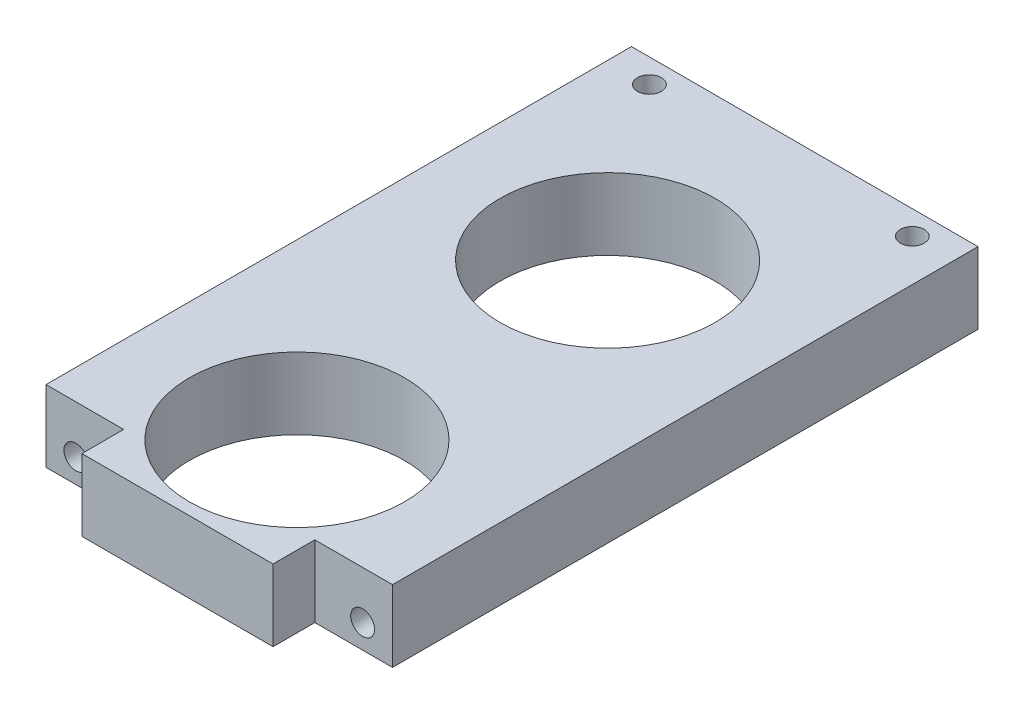
from build123d import *

# Parameters (mm, degrees)
SKETCH_1_W          = 29
SKETCH_1_H          = 52.5
SKETCH_1_R          = 9
EXTRUDE_1_DEPTH     = 6
SKETCH_2_W          = 6.5
SKETCH_2_H          = 3.5
CUT_EXTRUDE_1_DEPTH = 10
SKETCH_3_R          = 1
CUT_EXTRUDE_4_DEPTH = 8
SKETCH_4_R          = 1
CUT_EXTRUDE_5_DEPTH = 10


with BuildPart() as part:
    # 草图1 → 凸台-拉伸1 (new body)
    with BuildSketch(Plane(origin=(0, 0, 0), x_dir=(1, 0, 0), z_dir=(0, 1, 0))):
        Rectangle(SKETCH_1_W, SKETCH_1_H)
        with Locations(Location((0, -16.25, 0), (0, 0, 270))):
            Circle(SKETCH_1_R, mode=Mode.SUBTRACT)
        with Locations(Location((0, 9.75, 0), (0, 0, 270))):
            Circle(SKETCH_1_R, mode=Mode.SUBTRACT)
    extrude(amount=EXTRUDE_1_DEPTH)

    # 草图2 → 切除-拉伸1 (cut)
    with BuildSketch(Plane(origin=(0, 6, 0), x_dir=(1, 0, 0), z_dir=(0, 1, 0))):
        with Locations((-11.25, -24.5)):
            Rectangle(SKETCH_2_W, SKETCH_2_H)
        with Locations((11.25, -24.5)):
            Rectangle(SKETCH_2_W, SKETCH_2_H)
    extrude(amount=-CUT_EXTRUDE_1_DEPTH, mode=Mode.SUBTRACT)

    # 草图3 → 切除-拉伸4 (cut)
    with BuildSketch(Plane.XY.offset(22.75)):
        with Locations((-12, 2)):
            Circle(SKETCH_3_R)
        with Locations((12, 2)):
            Circle(SKETCH_3_R)
    extrude(amount=-CUT_EXTRUDE_4_DEPTH, mode=Mode.SUBTRACT)

    # 草图4 → 切除-拉伸5 (cut)
    with BuildSketch(Plane(origin=(0, 6, 0), x_dir=(1, 0, 0), z_dir=(0, 1, 0))):
        with Locations(Location((-11, 24.25, 0), (0, 0, 270))):
            Circle(SKETCH_4_R)
        with Locations(Location((11, 24.25, 0), (0, 0, 270))):
            Circle(SKETCH_4_R)
    extrude(amount=-CUT_EXTRUDE_5_DEPTH, mode=Mode.SUBTRACT)


solid = part.part
